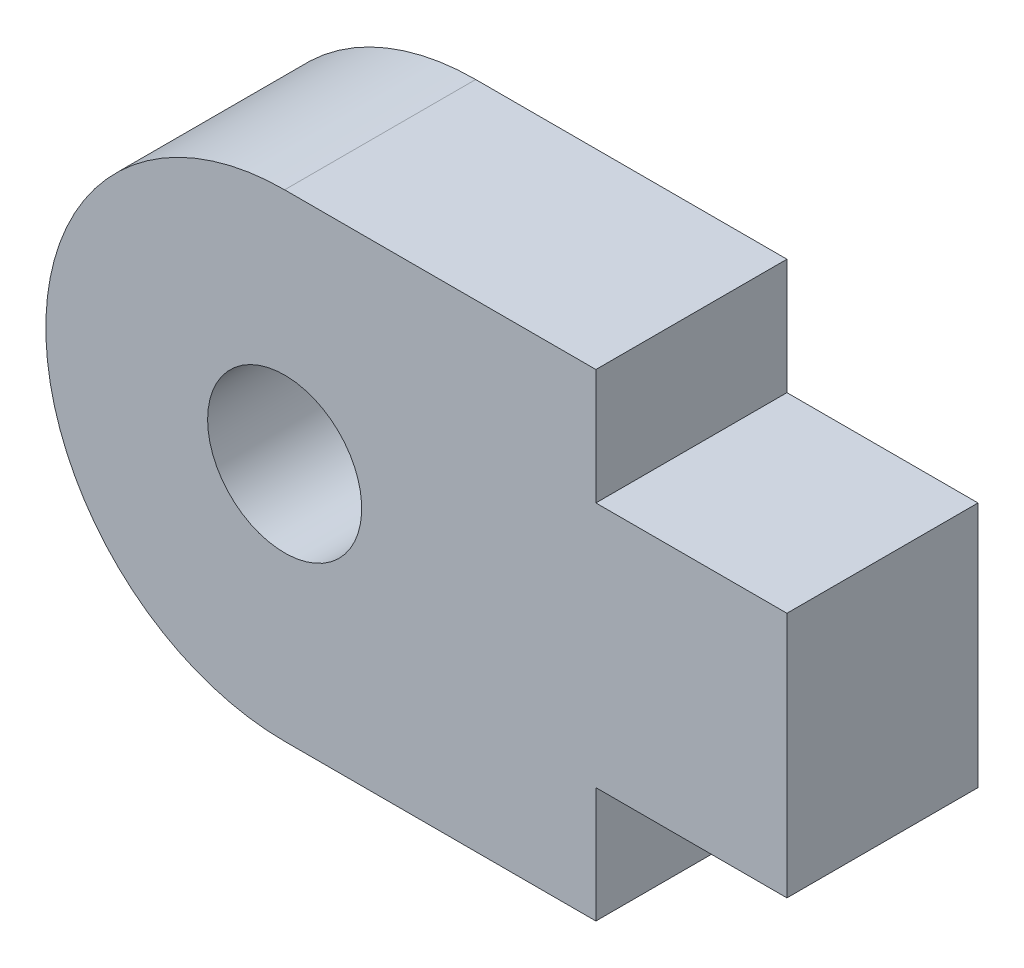
from build123d import *

# Parameters (mm, degrees)
SKETCH1_R      = 1.25
EXTRUDE1_DEPTH = 3.1


with BuildPart() as part:
    # Sketch1 → Extrude1 (new body)
    with BuildSketch(Plane.XY):
        with BuildLine():
            Line((-19.191802054, 13.266728144), (-19.191802054, 11.391728144))
            Line((-19.191802054, 11.391728144), (-16.091802054, 11.391728144))
            Line((-16.091802054, 11.391728144), (-16.091802054, 7.391728144))
            Line((-16.091802054, 7.391728144), (-19.191802054, 7.391728144))
            Line((-19.191802054, 7.391728144), (-19.191802054, 5.516728144))
            Line((-19.191802054, 5.516728144), (-24.241802054, 5.516728144))
            ThreePointArc((-24.241802054, 5.516728144), (-28.116802054, 9.391728144), (-24.241802054, 13.266728144))
            Line((-24.241802054, 13.266728144), (-19.191802054, 13.266728144))
        make_face()
        with Locations(Location((-24.241802054, 9.414269496, 0), (0, 0, 180))):
            Circle(SKETCH1_R, mode=Mode.SUBTRACT)
    extrude(amount=EXTRUDE1_DEPTH)


solid = part.part
